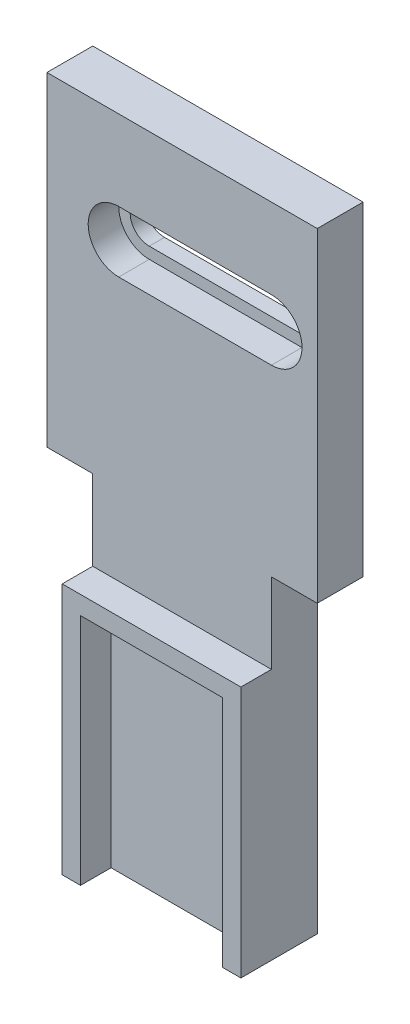
from build123d import *

# Parameters (mm, degrees)
SKETCH1_W           = 17.7
SKETCH1_H           = 43
BOSS_EXTRUDE1_DEPTH = 3
SKETCH2_W           = 3
SKETCH2_H           = 21.75
CUT_EXTRUDE1_DEPTH  = 56.240991234
CUT_EXTRUDE2_DEPTH  = 56.240991234
CUT_EXTRUDE3_DEPTH  = 2
SKETCH5_W           = 11.7
SKETCH5_H           = 16.5
BOSS_EXTRUDE2_DEPTH = 2
SKETCH6_W           = 9.3
SKETCH6_H           = 15.3
CUT_EXTRUDE4_DEPTH  = 2


with BuildPart() as part:
    # Sketch1 → Boss-Extrude1 (new body)
    with BuildSketch(Plane.XY):
        with Locations((-34.564285714, 12.525974026)):
            Rectangle(SKETCH1_W, SKETCH1_H)
    extrude(amount=BOSS_EXTRUDE1_DEPTH)

    # Sketch2 → Cut-Extrude1 (cut, through all)
    with BuildSketch(Plane.XY.offset(3)):
        with Locations((-41.914285714, 1.900974026)):
            Rectangle(SKETCH2_W, SKETCH2_H)
        with Locations((-27.214285714, 1.900974026)):
            Rectangle(SKETCH2_W, SKETCH2_H)
    extrude(amount=-CUT_EXTRUDE1_DEPTH, mode=Mode.SUBTRACT)

    # Sketch3 → Cut-Extrude2 (cut, through all)
    with BuildSketch(Plane.XY.offset(3)):
        with BuildLine():
            Line((-28.714285714, 25.525974026), (-38.714285714, 25.525974026))
            ThreePointArc((-38.714285714, 25.525974026), (-39.964285714, 26.775974026), (-38.714285714, 28.025974026))
            Line((-38.714285714, 28.025974026), (-28.714285714, 28.025974026))
            ThreePointArc((-28.714285714, 28.025974026), (-27.464285714, 26.775974026), (-28.714285714, 25.525974026))
        make_face()
    extrude(amount=-CUT_EXTRUDE2_DEPTH, mode=Mode.SUBTRACT)

    # Sketch4 → Cut-Extrude3 (cut)
    with BuildSketch(Plane.XY.offset(3)):
        with BuildLine():
            Line((-38.714285714, 28.775974026), (-28.714285714, 28.775974026))
            ThreePointArc((-28.714285714, 28.775974026), (-26.714285714, 26.775974026), (-28.714285714, 24.775974026))
            Line((-28.714285714, 24.775974026), (-38.714285714, 24.775974026))
            ThreePointArc((-38.714285714, 24.775974026), (-40.714285714, 26.775974026), (-38.714285714, 28.775974026))
        make_face()
    extrude(amount=-CUT_EXTRUDE3_DEPTH, mode=Mode.SUBTRACT)

    # Sketch5 → Boss-Extrude2 (add)
    with BuildSketch(Plane.XY.offset(3)):
        with Locations((-34.564285714, -0.724025974)):
            Rectangle(SKETCH5_W, SKETCH5_H)
    extrude(amount=BOSS_EXTRUDE2_DEPTH)

    # Sketch6 → Cut-Extrude4 (cut)
    with BuildSketch(Plane.XY.offset(5)):
        with Locations((-34.564285714, -1.324025974)):
            Rectangle(SKETCH6_W, SKETCH6_H)
    extrude(amount=-CUT_EXTRUDE4_DEPTH, mode=Mode.SUBTRACT)


solid = part.part
